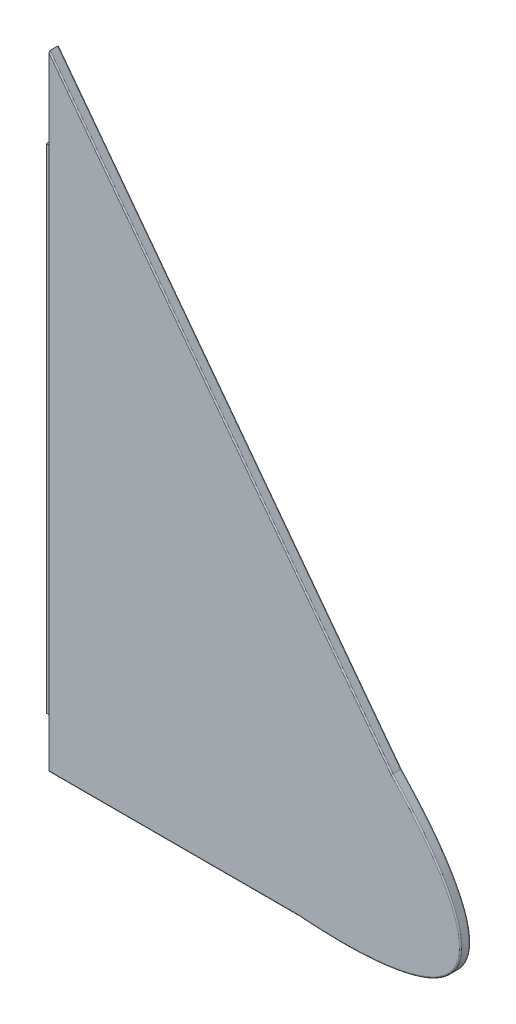
from build123d import *

# Parameters (mm, degrees)
BOSS_EXTRUDE1_DEPTH = 0.8
FILLET1_R           = 0.1
SKETCH4_W           = 0.254
SKETCH4_H           = 40.64
BOSS_EXTRUDE3_DEPTH = 0.5


with BuildPart() as part:
    # Sketch1 → Boss-Extrude1 (new body)
    with BuildSketch(Plane.XY.offset(3)):
        with BuildLine():
            Line((28.243534359, 13.954563985), (0, 51.435))
            Line((0, 51.435), (0, 0))
            Line((0, 0), (20.574, 0))
            add(Edge.make_bspline(
                [(28.243534359, 13.954563985), (28.255374505, 13.941816069), (28.267208988, 13.92906289), (28.279037761, 13.91630442), (30.153345257, 11.894683484), (32.006470675, 9.744783325), (33.16422455, 7.242866907), (33.401756078, 6.729559162), (33.604946542, 6.195863778), (33.739020824, 5.646382064), (33.874347935, 5.091765833), (33.939913411, 4.505626773), (33.871511856, 3.938851846), (33.827617784, 3.575145789), (33.725456416, 3.212704812), (33.564721495, 2.883504158), (33.403808248, 2.553938278), (33.180869438, 2.250341133), (32.922194702, 1.990352435), (32.56522117, 1.631565624), (32.133735138, 1.343182648), (31.683027893, 1.112919628), (30.846809444, 0.685701767), (29.922085937, 0.431306313), (28.999759762, 0.254980424), (26.239869032, -0.272642233), (23.37752863, -0.188705407), (20.574, 0)],
                knots=[0.079808544, 0.079808544, 0.079808544, 0.079808544, 0.079859283, 0.079859283, 0.079859283, 0.087953073, 0.087953073, 0.087953073, 0.089587331, 0.089587331, 0.089587331, 0.091249286, 0.091249286, 0.091249286, 0.092309053, 0.092309053, 0.092309053, 0.093369651, 0.093369651, 0.093369651, 0.09483636, 0.09483636, 0.09483636, 0.097565638, 0.097565638, 0.097565638, 0.10582116, 0.10582116, 0.10582116, 0.10582116], degree=3))
        make_face()
    extrude(amount=-BOSS_EXTRUDE1_DEPTH)

    # Fillet1
    fillet1_edges = [part.edges().sort_by_distance(p)[0] for p in [
        (10.287, 0, 2.2),
        (33.302877827, 2.442692352, 2.2),
        (10.287, 0, 3),
        (14.121767179, 32.694781993, 3),
        (33.302877827, 2.442692352, 3),
        (20.574, 0, 2.6),
        (28.243534359, 13.954563985, 2.6),
        (14.121767179, 32.694781993, 2.2),
    ]]
    fillet(fillet1_edges, radius=FILLET1_R)

    # Sketch4 → Boss-Extrude3 (add)
    with BuildSketch(Plane.ZY):
        with Locations((2.5936, 24.13)):
            Rectangle(SKETCH4_W, SKETCH4_H)
    extrude(amount=BOSS_EXTRUDE3_DEPTH)


solid = part.part
